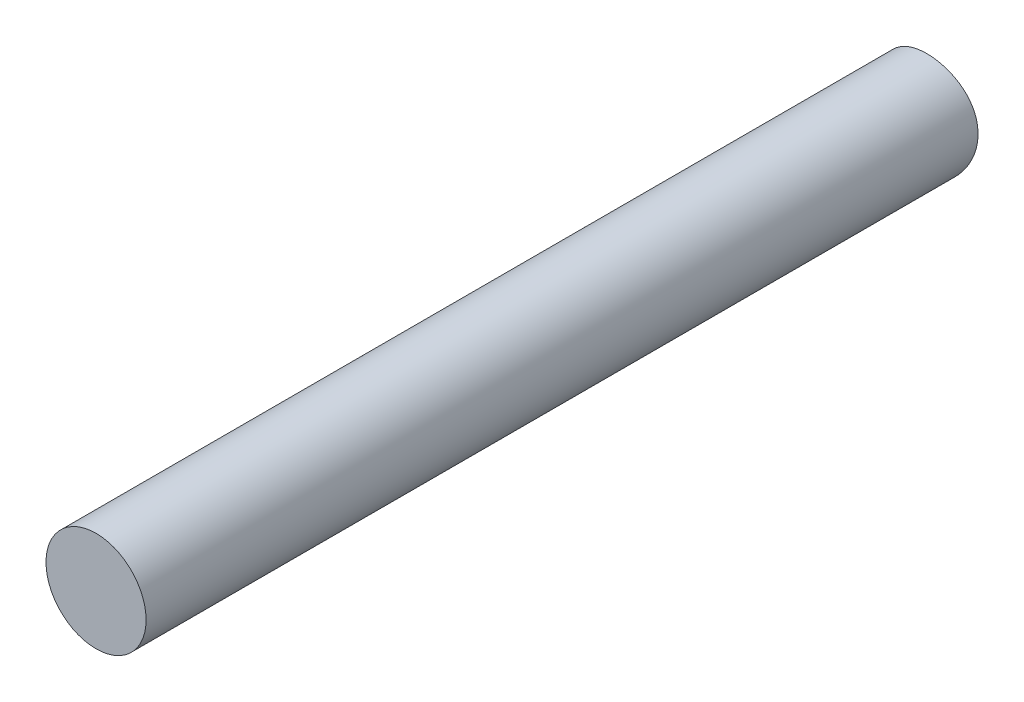
from build123d import *

# Parameters (mm, degrees)
SKETCH1_R           = 6
BOSS_EXTRUDE1_DEPTH = 100
CUT_EXTRUDE3_REACH  = 103.605


with BuildPart() as part:
    # Sketch1 → Boss-Extrude1 (new body)
    with BuildSketch(Plane.XY):
        Circle(SKETCH1_R)
    extrude(amount=BOSS_EXTRUDE1_DEPTH)

    # Sketch4 → Cut-Extrude3 (cut, up to next)
    with BuildSketch(Plane(origin=(0, 5.910887179, -0.725765687), x_dir=(1, 0, 0), z_dir=(0, 0.9925461516413233, -0.12186934340513747)), mode=Mode.PRIVATE) as cut_extrude3_sk1:
        with BuildLine():
            Line((-6, -0.278187617), (-6, 1.737673663))
            Line((-6, 1.737673663), (6, 1.737673663))
            Line((6, 1.737673663), (6, -0.278187617))
            ThreePointArc((6, -0.278187617), (0, -1.112177128), (-6, -0.278187617))
        make_face()
    cut_extrude3_tool1 = extrude(cut_extrude3_sk1.sketch, amount=-CUT_EXTRUDE3_REACH, mode=Mode.PRIVATE) & part.part
    add(cut_extrude3_tool1.solids().sort_by_distance((0, 5.857419, -1.161228))[0], mode=Mode.SUBTRACT)


solid = part.part
